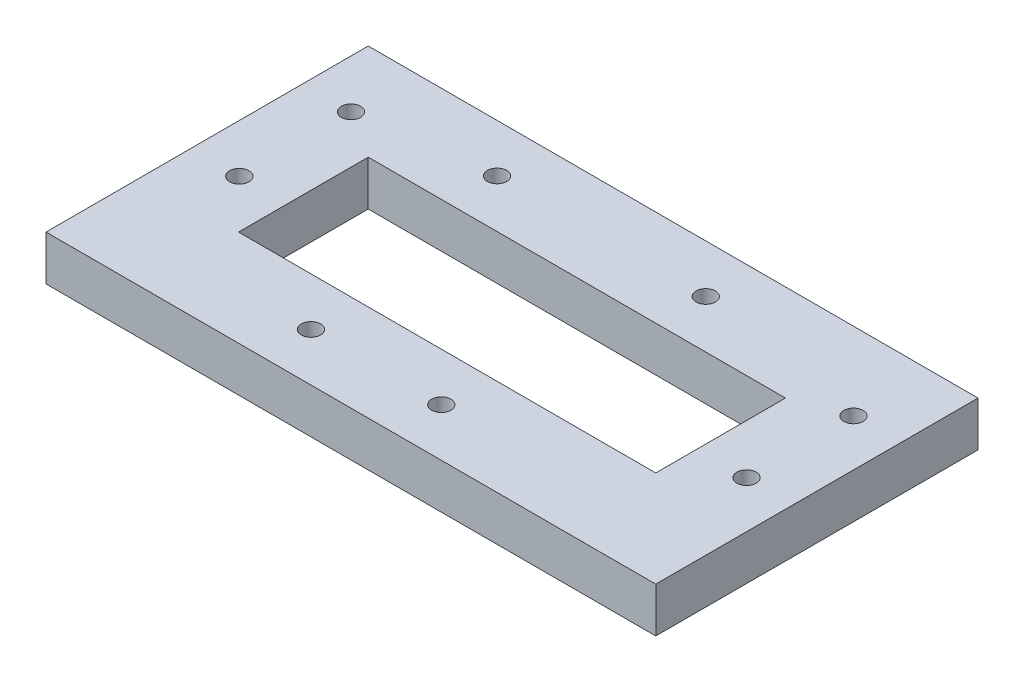
from build123d import *

# Parameters (mm, degrees)
SKETCH2_W           = 94.999999992
SKETCH2_H           = 50.20499992
SKETCH2_R           = 1.5
SKETCH2_W_2         = 64.999999992
SKETCH2_H_2         = 20.20499992
BOSS_EXTRUDE2_DEPTH = 7


with BuildPart() as part:
    # Sketch2 → Boss-Extrude2 (new body)
    with BuildSketch(Plane(origin=(0, 0, 0), x_dir=(1, 0, 0), z_dir=(0, 1, 0))):
        Rectangle(SKETCH2_W, SKETCH2_H)
        with Locations(Location((-19.935762724, 17.60249996, 0), (0, 0, 270))):
            Circle(SKETCH2_R, mode=Mode.SUBTRACT)
        with Locations(Location((12.584576228, 17.60249996, 0), (0, 0, 270))):
            Circle(SKETCH2_R, mode=Mode.SUBTRACT)
        with Locations(Location((-39.970648897, 14.877942076, 0), (0, 0, 270))):
            Circle(SKETCH2_R, mode=Mode.SUBTRACT)
        with Locations(Location((-39.970648897, -2.517744737, 0), (0, 0, 270))):
            Circle(SKETCH2_R, mode=Mode.SUBTRACT)
        with Locations(Location((40.207477372, 12.990674167, 0), (0, 0, 270))):
            Circle(SKETCH2_R, mode=Mode.SUBTRACT)
        with Locations(Location((40.207477372, -3.666516508, 0), (0, 0, 270))):
            Circle(SKETCH2_R, mode=Mode.SUBTRACT)
        with Locations(Location((-13.716054438, -17.60249996, 0), (0, 0, 270))):
            Circle(SKETCH2_R, mode=Mode.SUBTRACT)
        with Locations(Location((6.580630125, -17.60249996, 0), (0, 0, 270))):
            Circle(SKETCH2_R, mode=Mode.SUBTRACT)
        Rectangle(SKETCH2_W_2, SKETCH2_H_2, mode=Mode.SUBTRACT)
    extrude(amount=BOSS_EXTRUDE2_DEPTH)


solid = part.part
